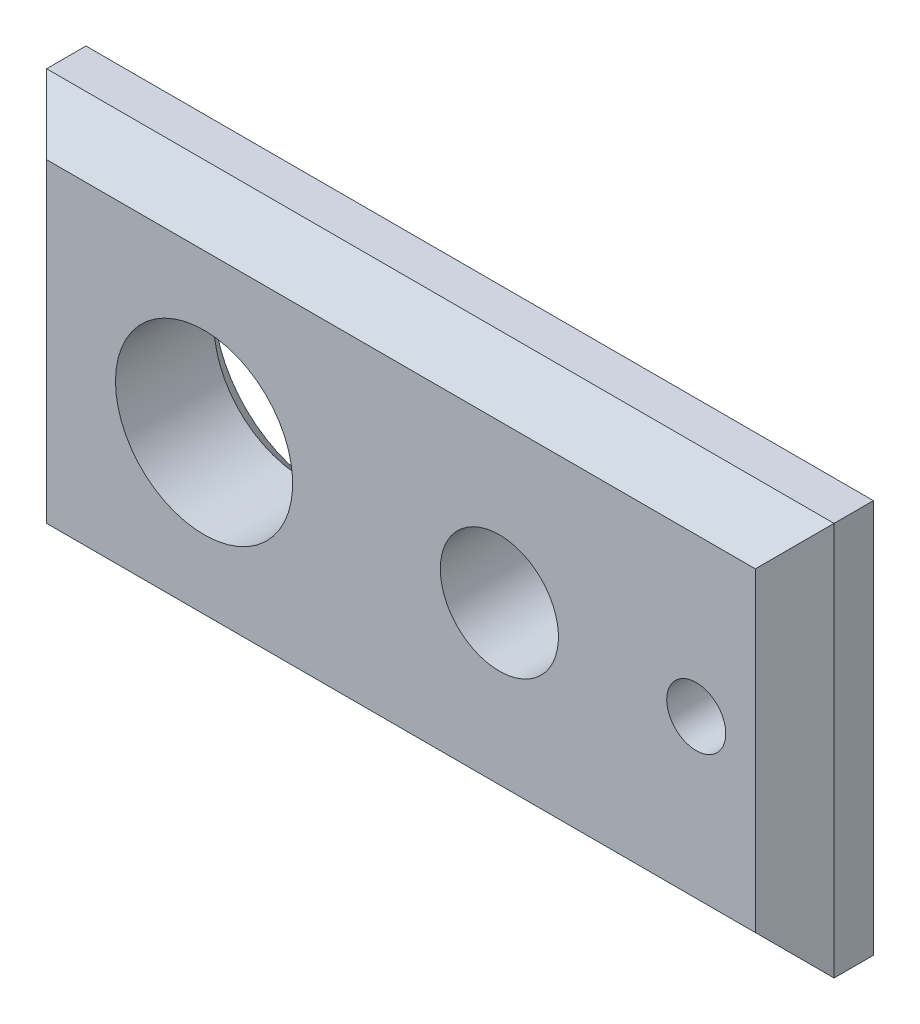
from build123d import *

# Parameters (mm, degrees)
ESQUISSE1_W             = 2000
ESQUISSE1_H             = 1000
BOSS_EXTRU_1_DEPTH      = 300
CHANFREIN1_SIZE         = 100
ESQUISSE2_R             = 75
ESQUISSE2_R_2           = 225
ESQUISSE2_R_3           = 150
ENL_V_MAT_EXTRU_1_DEPTH = 1158.583690279
CHANFREIN2_SIZE         = 50


with BuildPart() as part:
    # Esquisse1 → Boss.-Extru.1 (new body)
    with BuildSketch(Plane.XY):
        Rectangle(ESQUISSE1_W, ESQUISSE1_H)
    extrude(amount=BOSS_EXTRU_1_DEPTH)

    # Chanfrein1
    chanfrein1_edges = [part.edges().sort_by_distance(p)[0] for p in [
        (-1000, 0, 300),
        (0, -500, 300),
        (1000, 0, 300),
        (0, -500, 0),
        (-1000, 0, 0),
        (0, 500, 0),
        (1000, 0, 0),
        (0, 500, 300),
    ]]
    chamfer(chanfrein1_edges, length=CHANFREIN1_SIZE)

    # Esquisse2 → Enlèv. mat.-Extru.1 (cut, through all)
    with BuildSketch(Plane(origin=(0, 0, 0), x_dir=(-1, 0, 0), z_dir=(0, 0, -1))):
        with Locations((-750, 0)):
            Circle(ESQUISSE2_R)
        with Locations((500, 0)):
            Circle(ESQUISSE2_R_2)
        with Locations((-250, 0)):
            Circle(ESQUISSE2_R_3)
    extrude(amount=-ENL_V_MAT_EXTRU_1_DEPTH, mode=Mode.SUBTRACT)

    # Chanfrein2
    chanfrein2_edges = [part.edges().sort_by_distance(p)[0] for p in [
        (825, 0, 0),
        (400, 0, 0),
        (-275, 0, 0),
    ]]
    chamfer(chanfrein2_edges, length=CHANFREIN2_SIZE)


solid = part.part
